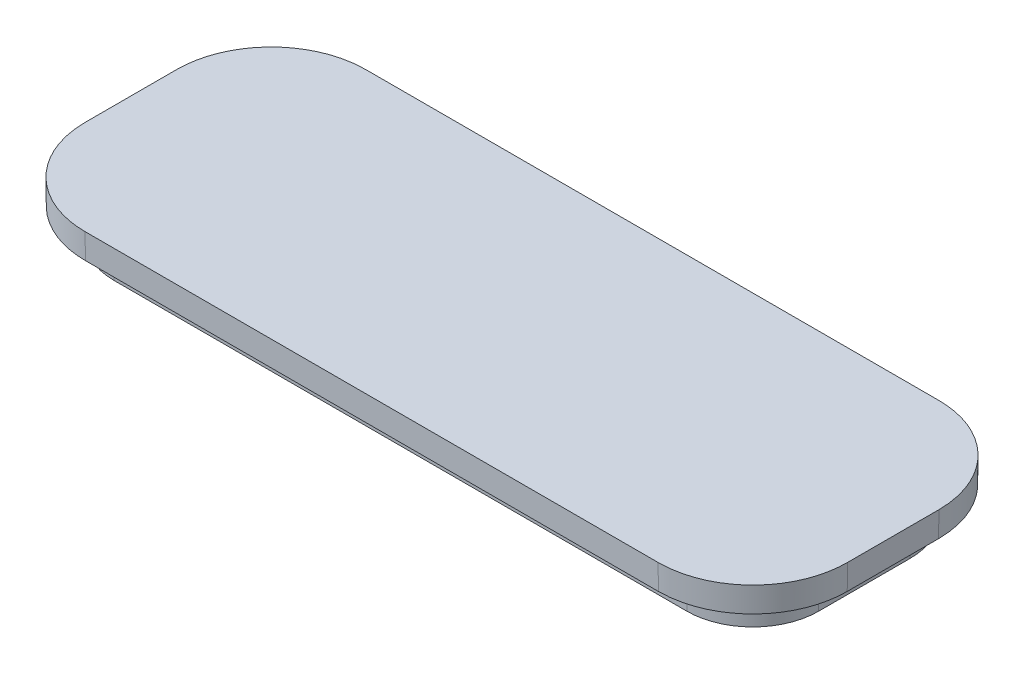
from build123d import *

# Parameters (mm, degrees)
SKETCH1_W           = 23.6
SKETCH1_H           = 8.3
BOSS_EXTRUDE1_DEPTH = 34.6
BOSS_EXTRUDE1_DRAFT = -0.5
FILLET1_R           = 3
BOSS_EXTRUDE2_DEPTH = 0.8
BOSS_EXTRUDE2_TAPER = -0.5
BOSS_EXTRUDE3_DEPTH = 1
BOSS_EXTRUDE3_TAPER = 0.5
FILLET2_R           = 0.5


with BuildPart() as part:
    # Sketch1 → Boss-Extrude1 (with draft: the straight prism first)
    with BuildSketch(Plane(origin=(0, 0, 0), x_dir=(1, 0, 0), z_dir=(0, 1, 0))):
        Rectangle(SKETCH1_W, SKETCH1_H)
    extrude(amount=BOSS_EXTRUDE1_DEPTH)
    # Boss-Extrude1: the draft: its side faces are tilted about the plane it starts from
    boss_extrude1_sides = [part.faces().sort_by_distance(p)[0] for p in [
        (0, 17.3, 4.15),
        (11.8, 17.3, 0),
        (0, 17.3, -4.15),
        (-11.8, 17.3, 0),
    ]]
    draft(boss_extrude1_sides, Plane(origin=(0, 0, 0), x_dir=(1, 0, 0), z_dir=(0, 1, 0)), BOSS_EXTRUDE1_DRAFT)

    # Fillet1
    fillet1_edges = [part.edges().sort_by_distance(p)[0] for p in [
        (11.950974813, 17.3, 4.300974813),
        (-11.950974813, 17.3, 4.300974813),
        (-11.950974813, 17.3, -4.300974813),
        (11.950974813, 17.3, -4.300974813),
    ]]
    fillet(fillet1_edges, radius=FILLET1_R)


with BuildPart() as body_2:
    # Sketch2 → Boss-Extrude2 (new body)
    with BuildSketch(Plane(origin=(0, 34.6, 0), x_dir=(1, 0, 0), z_dir=(0, 1, 0))):
        with BuildLine():
            Line((9.102063856, 4.451949626), (-9.102063856, 4.451949626))
            add(Edge.make_bspline(
                [(-9.102063856, 4.451949626), (-12.101949626, 4.451949626), (-12.101949626, 1.452063856)],
                knots=[2.356232566, 2.356232566, 2.356232566, 3.926952741, 3.926952741, 3.926952741], degree=2, weights=[1, 0.707133705, 1]))
            Line((-12.101949626, 1.452063856), (-12.101949626, -1.452063856))
            add(Edge.make_bspline(
                [(-12.101949626, -1.452063856), (-12.101949626, -4.451949626), (-9.102063856, -4.451949626)],
                knots=[5.49782522, 5.49782522, 5.49782522, 7.068545394, 7.068545394, 7.068545394], degree=2, weights=[1, 0.707133705, 1]))
            Line((-9.102063856, -4.451949626), (9.102063856, -4.451949626))
            add(Edge.make_bspline(
                [(9.102063856, -4.451949626), (12.101949626, -4.451949626), (12.101949626, -1.452063856)],
                knots=[2.356232566, 2.356232566, 2.356232566, 3.926952741, 3.926952741, 3.926952741], degree=2, weights=[1, 0.707133705, 1]))
            Line((12.101949626, -1.452063856), (12.101949626, 1.452063856))
            add(Edge.make_bspline(
                [(12.101949626, 1.452063856), (12.101949626, 4.451949626), (9.102063856, 4.451949626)],
                knots=[2.356232566, 2.356232566, 2.356232566, 3.926952741, 3.926952741, 3.926952741], degree=2, weights=[1, 0.707133705, 1]))
        make_face()
    extrude(amount=BOSS_EXTRUDE2_DEPTH, taper=BOSS_EXTRUDE2_TAPER)

    # Sketch3 → Boss-Extrude3 (add)
    with BuildSketch(Plane.XZ.offset(-34.6)):
        with BuildLine():
            Line((11.201949626, -1.452063856), (11.201949626, 1.452063856))
            add(Edge.make_bspline(
                [(11.201949626, 1.452063856), (11.201949626, 1.590755322), (11.18816877, 1.727101387), (11.134861687, 1.99541184), (11.094683362, 2.128782823), (10.989368965, 2.382966225), (10.924762337, 2.50344102), (10.772498082, 2.731626299), (10.68402799, 2.839769424), (10.39372147, 3.130210551), (10.159658129, 3.286662689), (9.654849284, 3.49624561), (9.379322108, 3.551949626), (9.102063856, 3.551949626)],
                knots=[0, 0, 0, 0, 0.125, 0.125, 0.25, 0.25, 0.375, 0.375, 0.5, 0.5, 0.75, 0.75, 1, 1, 1, 1], degree=3))
            Line((9.102063856, 3.551949626), (-9.102063856, 3.551949626))
            add(Edge.make_bspline(
                [(-9.102063856, 3.551949626), (-9.240755322, 3.551949626), (-9.377101387, 3.53816877), (-9.64541184, 3.484861687), (-9.778782823, 3.444683362), (-10.032966225, 3.339368965), (-10.15344102, 3.274762337), (-10.381626299, 3.122498082), (-10.489769424, 3.03402799), (-10.780210551, 2.74372147), (-10.936662689, 2.509658129), (-11.14624561, 2.004849284), (-11.201949626, 1.729322108), (-11.201949626, 1.452063856)],
                knots=[0, 0, 0, 0, 0.125, 0.125, 0.25, 0.25, 0.375, 0.375, 0.5, 0.5, 0.75, 0.75, 1, 1, 1, 1], degree=3))
            Line((-11.201949626, 1.452063856), (-11.201949626, -1.452063856))
            add(Edge.make_bspline(
                [(-11.201949626, -1.452063856), (-11.201949626, -1.590755322), (-11.18816877, -1.727101387), (-11.134861687, -1.99541184), (-11.094683362, -2.128782823), (-10.989368965, -2.382966225), (-10.924762337, -2.50344102), (-10.772498082, -2.731626299), (-10.68402799, -2.839769424), (-10.39372147, -3.130210551), (-10.159658129, -3.286662689), (-9.654849284, -3.49624561), (-9.379322108, -3.551949626), (-9.102063856, -3.551949626)],
                knots=[0, 0, 0, 0, 0.125, 0.125, 0.25, 0.25, 0.375, 0.375, 0.5, 0.5, 0.75, 0.75, 1, 1, 1, 1], degree=3))
            Line((-9.102063856, -3.551949626), (9.102063856, -3.551949626))
            add(Edge.make_bspline(
                [(9.102063856, -3.551949626), (9.240755322, -3.551949626), (9.377101387, -3.53816877), (9.64541184, -3.484861687), (9.778782823, -3.444683362), (10.032966225, -3.339368965), (10.15344102, -3.274762337), (10.381626299, -3.122498082), (10.489769424, -3.03402799), (10.780210551, -2.74372147), (10.936662689, -2.509658129), (11.14624561, -2.004849284), (11.201949626, -1.729322108), (11.201949626, -1.452063856)],
                knots=[0, 0, 0, 0, 0.125, 0.125, 0.25, 0.25, 0.375, 0.375, 0.5, 0.5, 0.75, 0.75, 1, 1, 1, 1], degree=3))
        make_face()
        with BuildLine():
            Line((-9.102063856, -2.651949626), (9.102063856, -2.651949626))
            add(Edge.make_bspline(
                [(9.102063856, -2.651949626), (9.40810099, -2.651949626), (10.045643797, -2.396322843), (10.301949626, -1.758266925), (10.301949626, -1.452063856)],
                knots=[0, 0, 0, 0, 0.5, 1, 1, 1, 1], degree=3))
            Line((10.301949626, -1.452063856), (10.301949626, 1.452063856))
            add(Edge.make_bspline(
                [(10.301949626, 1.452063856), (10.301949626, 1.75810099), (10.046322843, 2.395643797), (9.408266925, 2.651949626), (9.102063856, 2.651949626)],
                knots=[0, 0, 0, 0, 0.5, 1, 1, 1, 1], degree=3))
            Line((9.102063856, 2.651949626), (-9.102063856, 2.651949626))
            add(Edge.make_bspline(
                [(-9.102063856, 2.651949626), (-9.40810099, 2.651949626), (-10.045643797, 2.396322843), (-10.301949626, 1.758266925), (-10.301949626, 1.452063856)],
                knots=[0, 0, 0, 0, 0.5, 1, 1, 1, 1], degree=3))
            Line((-10.301949626, 1.452063856), (-10.301949626, -1.452063856))
            add(Edge.make_bspline(
                [(-10.301949626, -1.452063856), (-10.301949626, -1.75810099), (-10.046322843, -2.395643797), (-9.408266925, -2.651949626), (-9.102063856, -2.651949626)],
                knots=[0, 0, 0, 0, 0.5, 1, 1, 1, 1], degree=3))
        make_face(mode=Mode.SUBTRACT)
    extrude(amount=BOSS_EXTRUDE3_DEPTH, taper=BOSS_EXTRUDE3_TAPER)

    # Fillet2
    fillet2_edges = [body_2.edges().sort_by_distance(p)[0] for p in [
        (-10.301949626, 34.6, 0),
        (-10.101056471, 34.6, -2.114717029),
        (0, 34.6, -2.651949626),
        (9.754492851, 34.6, -2.457670799),
        (10.301949626, 34.6, 0),
        (10.10105647, 34.6, 2.11471703),
        (0, 34.6, 2.651949626),
        (-9.75449285, 34.6, 2.457670799),
    ]]
    fillet(fillet2_edges, radius=FILLET2_R)


solid = body_2.part
